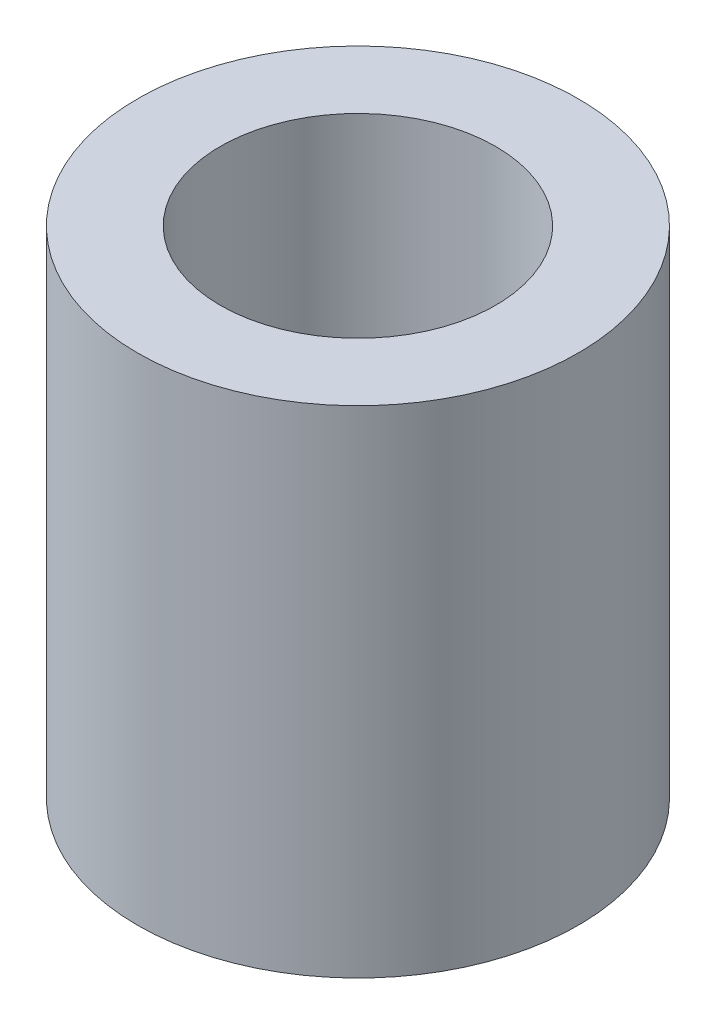
from build123d import *

# Parameters (mm, degrees)
SKETCH1_R           = 10.16
SKETCH1_R_2         = 6.35
BOSS_EXTRUDE1_DEPTH = 22.86


with BuildPart() as part:
    # Sketch1 → Boss-Extrude1 (new body)
    with BuildSketch(Plane(origin=(0, 0, 0), x_dir=(1, 0, 0), z_dir=(0, 1, 0))):
        with Locations(Location((0, 0, 0), (0, 0, 270))):
            Circle(SKETCH1_R)
        with Locations(Location((0, 0, 0), (0, 0, 270))):
            Circle(SKETCH1_R_2, mode=Mode.SUBTRACT)
    extrude(amount=BOSS_EXTRUDE1_DEPTH)


solid = part.part
